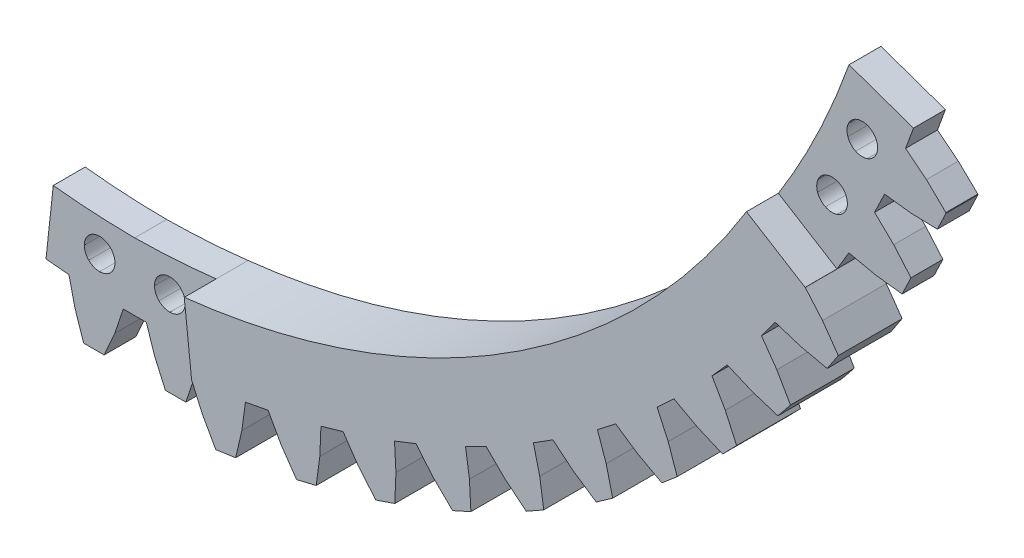
from build123d import *

# Parameters (mm, degrees)
BOSS_EXTRUDE1_DEPTH = 4
BOSS_EXTRUDE2_DEPTH = 2


with BuildPart() as part:
    # Model → Boss-Extrude1 (new body)
    with BuildSketch(Plane.XY):
        with BuildLine():
            Line((92.895208, 49.447014), (89.220257, 51.716368))
            add(Edge.make_bspline(
                [(89.220257, 51.716368), (81.532777, 39.265232), (68.535499, 31.052304), (53.989882, 29.454437)],
                knots=[0, 0, 0, 0, 1, 1, 1, 1], degree=3))
            Line((53.989882, 29.454437), (54.450147, 25.204015))
            Line((54.450147, 25.204015), (55.123732, 23.678801))
            Line((55.123732, 23.678801), (55.962683, 22.178945))
            Line((55.962683, 22.178945), (57.209532, 22.355334))
            Line((57.209532, 22.355334), (57.598688, 24.029375))
            Line((57.598688, 24.029375), (57.821932, 25.681919))
            Line((57.821932, 25.681919), (59.241312, 25.951464))
            Line((59.241312, 25.951464), (60.054355, 24.495702))
            Line((60.054355, 24.495702), (61.030556, 23.080733))
            Line((61.030556, 23.080733), (62.254805, 23.373428))
            Line((62.254805, 23.373428), (62.485764, 25.076132))
            Line((62.485764, 25.076132), (62.553562, 26.742456))
            Line((62.553562, 26.742456), (63.940972, 27.143742))
            Line((63.940972, 27.143742), (64.88741, 25.770664))
            Line((64.88741, 25.770664), (65.991492, 24.453259))
            Line((65.991492, 24.453259), (67.18322, 24.859506))
            Line((67.18322, 24.859506), (67.253776, 26.576541))
            Line((67.253776, 26.576541), (67.165031, 28.241762))
            Line((67.165031, 28.241762), (68.508894, 28.770928))
            Line((68.508894, 28.770928), (69.579355, 27.492659))
            Line((69.579355, 27.492659), (70.80195, 26.284395))
            Line((70.80195, 26.284395), (71.950682, 26.800334))
            Line((71.950682, 26.800334), (71.85973, 28.516268))
            Line((71.85973, 28.516268), (71.615543, 30.166055))
            Line((71.615543, 30.166055), (72.904285, 30.818693))
            Line((72.904285, 30.818693), (74.089949, 29.646258))
            Line((74.089949, 29.646258), (75.420031, 28.558158))
            Line((75.420031, 28.558158), (76.515296, 29.17938))
            Line((76.515296, 29.17938), (76.264493, 30.879326))
            Line((76.264493, 30.879326), (75.866515, 32.498799))
            Line((75.866515, 32.498799), (77.08856, 33.269395))
            Line((77.08856, 33.269395), (78.378953, 32.212716))
            Line((78.378953, 32.212716), (79.804949, 31.254154))
            Line((79.804949, 31.254154), (80.837374, 31.975144))
            Line((80.837374, 31.975144), (80.428372, 33.644223))
            Line((80.428372, 33.644223), (79.880466, 35.219596))
            Line((79.880466, 35.219596), (81.024786, 36.10099))
            Line((81.024786, 36.10099), (82.408339, 35.169987))
            Line((82.408339, 35.169987), (83.918117, 34.348675))
            Line((83.918117, 34.348675), (84.878333, 35.163372))
            Line((84.878333, 35.163372), (84.314992, 36.786703))
            Line((84.314992, 36.786703), (83.622114, 38.303647))
            Line((83.622114, 38.303647), (84.678794, 39.288668))
            Line((84.678794, 39.288668), (86.143372, 38.49106))
            Line((86.143372, 38.49106), (87.723156, 37.81527))
            Line((87.723156, 37.81527), (88.602896, 38.715954))
            Line((88.602896, 38.715954), (87.890175, 40.279753))
            Line((87.890175, 40.279753), (87.05839, 41.725039))
            Line((87.05839, 41.725039), (88.018056, 42.804318))
            Line((88.018056, 42.804318), (89.550985, 42.147822))
            Line((89.550985, 42.147822), (91.186993, 41.622513))
            Line((91.186993, 41.622513), (91.978536, 42.602022))
            Line((91.978536, 42.602022), (91.1225, 44.091957))
            Line((91.1225, 44.091957), (90.158976, 45.452909))
            Line((90.158976, 45.452909), (91.013359, 46.617626))
            Line((91.013359, 46.617626), (92.600859, 46.107202))
            Line((92.600859, 46.107202), (94.279311, 45.737886))
            Line((94.279311, 45.737886), (94.975494, 46.786849))
            Line((94.975494, 46.786849), (93.983858, 48.189691))
            Line((93.983858, 48.189691), (92.902374, 49.448117))
            Line((92.902374, 49.448117), (92.895208, 49.447014))
        make_face()
    extrude(amount=BOSS_EXTRUDE1_DEPTH)

    # Model<3> → Boss-Extrude2 (add)
    # profile 1 of 2: a face of its own
    with BuildSketch(Plane.XY):
        with BuildLine():
            Line((97.191932, 58.138025), (97.686924, 59.486299))
            Line((97.686924, 59.486299), (93.647618, 60.905126))
            add(Edge.make_bspline(
                [(93.647618, 60.905126), (92.505915, 57.692177), (91.021572, 54.611501), (89.220257, 51.716368)],
                knots=[0, 0, 0, 0, 1, 1, 1, 1], degree=3))
            Line((89.220257, 51.716368), (92.895208, 49.447014))
            Line((92.895208, 49.447014), (92.902374, 49.448117))
            Line((92.902374, 49.448117), (92.896862, 49.45473))
            Line((92.896862, 49.45473), (93.638799, 50.694414))
            Line((93.638799, 50.694414), (95.267089, 50.33502))
            Line((95.267089, 50.33502), (96.972549, 50.124457))
            Line((96.972549, 50.124457), (96.988534, 50.154223))
            Line((96.988534, 50.154223), (97.52707, 51.281458))
            Line((97.52707, 51.281458), (96.448894, 52.538231))
            Line((96.448894, 52.538231), (95.248346, 53.695782))
            Line((95.248346, 53.695782), (95.870669, 54.999406))
            Line((95.870669, 54.999406), (97.525417, 54.793801))
            Line((97.525417, 54.793801), (99.181818, 54.745296))
            Line((99.181818, 54.745296), (99.706577, 55.844969))
            Line((99.706577, 55.844969), (99.729174, 55.897886))
            Line((99.729174, 55.897886), (99.7176, 55.918282))
            Line((99.7176, 55.918282), (98.495556, 57.097881))
            Line((98.495556, 57.097881), (97.191932, 58.138025))
        make_face()
        with BuildLine():
            add(Edge.make_bspline(
                [(92.262217, 54.225537), (92.502615, 54.310525), (92.766927, 54.296534), (92.997009, 54.186643)],
                knots=[0, 0, 0, 0, 1, 1, 1, 1], degree=3))
            add(Edge.make_bspline(
                [(92.997009, 54.186643), (93.227091, 54.076751), (93.404095, 53.879961), (93.489083, 53.639564)],
                knots=[0, 0, 0, 0, 1, 1, 1, 1], degree=3))
            add(Edge.make_bspline(
                [(93.489083, 53.639564), (93.57407, 53.399166), (93.560079, 53.134854), (93.340297, 52.67469), (93.143506, 52.497686), (92.903109, 52.412698)],
                knots=[0, 0, 0, 0, 1, 1, 2, 2, 2, 2], degree=3))
            add(Edge.make_bspline(
                [(92.903109, 52.412698), (92.662712, 52.327711), (92.398399, 52.341702), (91.938235, 52.561484), (91.761231, 52.758275), (91.676244, 52.998672)],
                knots=[0, 0, 0, 0, 1, 1, 2, 2, 2, 2], degree=3))
            add(Edge.make_bspline(
                [(91.676244, 52.998672), (91.591256, 53.239069), (91.605247, 53.503382), (91.715138, 53.733464)],
                knots=[0, 0, 0, 0, 1, 1, 1, 1], degree=3))
            add(Edge.make_bspline(
                [(91.715138, 53.733464), (91.82503, 53.963546), (92.02182, 54.14055), (92.262217, 54.225537)],
                knots=[0, 0, 0, 0, 1, 1, 1, 1], degree=3))
        make_face(mode=Mode.SUBTRACT)
        with BuildLine():
            add(Edge.make_bspline(
                [(94.158504, 58.195833), (94.398901, 58.280821), (94.663214, 58.26683), (94.893295, 58.156939)],
                knots=[0, 0, 0, 0, 1, 1, 1, 1], degree=3))
            add(Edge.make_bspline(
                [(94.893295, 58.156939), (95.123377, 58.047047), (95.300382, 57.850257), (95.385369, 57.60986)],
                knots=[0, 0, 0, 0, 1, 1, 1, 1], degree=3))
            add(Edge.make_bspline(
                [(95.385369, 57.60986), (95.470357, 57.369462), (95.456366, 57.10515), (95.346474, 56.875068)],
                knots=[0, 0, 0, 0, 1, 1, 1, 1], degree=3))
            add(Edge.make_bspline(
                [(95.346474, 56.875068), (95.236583, 56.644986), (95.039793, 56.467982), (94.799396, 56.382994)],
                knots=[0, 0, 0, 0, 1, 1, 1, 1], degree=3))
            add(Edge.make_bspline(
                [(94.799396, 56.382994), (94.558998, 56.298007), (94.294686, 56.311998), (93.834522, 56.53178), (93.657518, 56.728571), (93.57253, 56.968968)],
                knots=[0, 0, 0, 0, 1, 1, 2, 2, 2, 2], degree=3))
            add(Edge.make_bspline(
                [(93.57253, 56.968968), (93.487543, 57.209365), (93.501533, 57.473678), (93.611425, 57.70376)],
                knots=[0, 0, 0, 0, 1, 1, 1, 1], degree=3))
            add(Edge.make_bspline(
                [(93.611425, 57.70376), (93.721316, 57.933842), (93.918106, 58.110846), (94.158504, 58.195833)],
                knots=[0, 0, 0, 0, 1, 1, 1, 1], degree=3))
        make_face(mode=Mode.SUBTRACT)
    # profile 2 of 2: a face of its own
    with BuildSketch(Plane.XY):
        with BuildLine():
            Line((54.450147, 25.204015), (53.989882, 29.454437))
            add(Edge.make_bspline(
                [(53.989882, 29.454437), (52.295366, 29.254238), (50.591295, 29.145491), (48.885077, 29.128668)],
                knots=[0, 0, 0, 0, 1, 1, 1, 1], degree=3))
            add(Edge.make_bspline(
                [(48.885077, 29.128668), (47.179833, 29.134367), (45.476132, 29.23189), (43.781376, 29.420813)],
                knots=[0, 0, 0, 0, 1, 1, 1, 1], degree=3))
            Line((43.781376, 29.420813), (43.325519, 25.203465))
            Line((43.325519, 25.203465), (44.763642, 25.068416))
            Line((44.763642, 25.068416), (45.141224, 23.443984))
            Line((45.141224, 23.443984), (45.685826, 21.814041))
            Line((45.685826, 21.814041), (46.969053, 21.814041))
            Line((46.969053, 21.814041), (47.638231, 23.327127))
            Line((47.638231, 23.327127), (48.165743, 24.909115))
            Line((48.165743, 24.909115), (49.609925, 24.909115))
            Line((49.609925, 24.909115), (50.137991, 23.327127))
            Line((50.137991, 23.327127), (50.806615, 21.814041))
            Line((50.806615, 21.814041), (52.078819, 21.814041))
            Line((52.078819, 21.814041), (52.090396, 21.814591))
            Line((52.090396, 21.814591), (52.634995, 23.444534))
            Line((52.634995, 23.444534), (53.012027, 25.068966))
            Line((53.012027, 25.068966), (54.450147, 25.204015))
        make_face()
        with BuildLine():
            add(Edge.make_bspline(
                [(46.005137, 26.474336), (45.82484, 26.654632), (45.72355, 26.899167), (45.72355, 27.409123), (45.82484, 27.653658), (46.185433, 28.014251), (46.429968, 28.115541), (46.939924, 28.115541), (47.184459, 28.014251), (47.545052, 27.653658), (47.646342, 27.409123), (47.646342, 26.899167), (47.545052, 26.654632), (47.364755, 26.474336)],
                knots=[0, 0, 0, 0, 1, 1, 2, 2, 2.999994454, 2.999994454, 3.999988907, 3.999988907, 4.999988907, 4.999988907, 5.999988907, 5.999988907, 5.999988907, 5.999988907], degree=3))
            add(Edge.make_bspline(
                [(47.364755, 26.474336), (47.184459, 26.294039), (46.939924, 26.192749), (46.429968, 26.192749), (46.185433, 26.294039), (46.005137, 26.474336)],
                knots=[0, 0, 0, 0, 1, 1, 2, 2, 2, 2], degree=3))
        make_face(mode=Mode.SUBTRACT)
        with BuildLine():
            add(Edge.make_bspline(
                [(51.764659, 27.833955), (51.944956, 27.653658), (52.046245, 27.409123), (52.046245, 26.899167), (51.944956, 26.654632), (51.764659, 26.474336)],
                knots=[0, 0, 0, 0, 1, 1, 2, 2, 2, 2], degree=3))
            add(Edge.make_bspline(
                [(51.764659, 26.474336), (51.584362, 26.294039), (51.339828, 26.192749), (50.829872, 26.192749), (50.585337, 26.294039), (50.224744, 26.654632), (50.123454, 26.899167), (50.123454, 27.409123), (50.224744, 27.653658), (50.40504, 27.833955)],
                knots=[0, 0, 0, 0, 1, 1, 2, 2, 2.999994454, 2.999994454, 3.999988907, 3.999988907, 3.999988907, 3.999988907], degree=3))
            add(Edge.make_bspline(
                [(50.40504, 27.833955), (50.585337, 28.014251), (50.829872, 28.115541), (51.339828, 28.115541), (51.584362, 28.014251), (51.764659, 27.833955)],
                knots=[0, 0, 0, 0, 1, 1, 2, 2, 2, 2], degree=3))
        make_face(mode=Mode.SUBTRACT)
    extrude(amount=BOSS_EXTRUDE2_DEPTH)


solid = part.part
